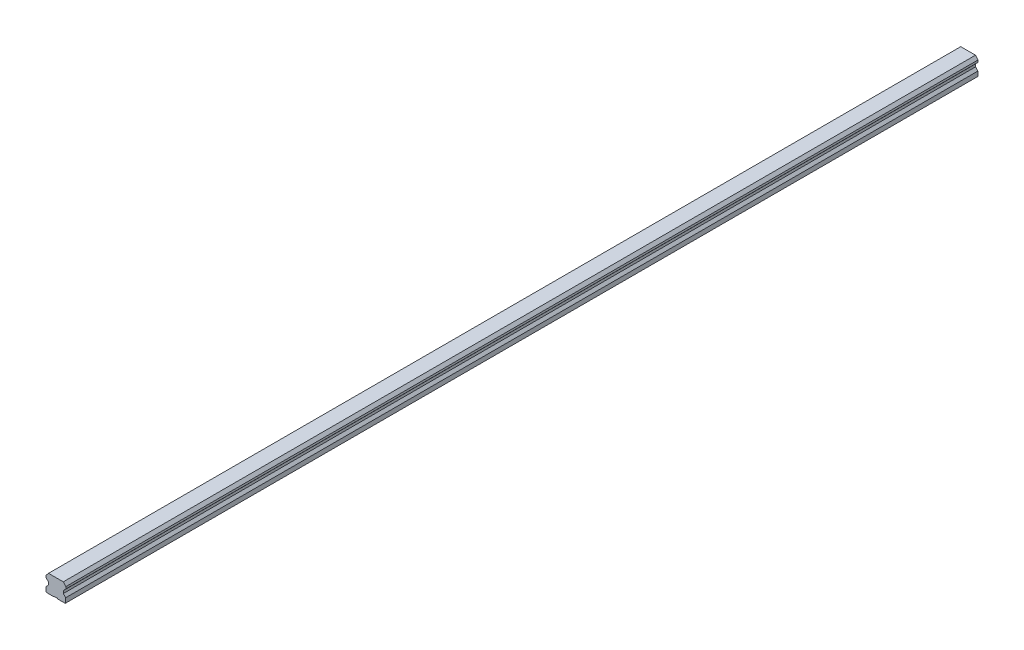
from build123d import *

# Parameters (mm, degrees)
EXTRUDE_1_DEPTH = 470


with BuildPart() as part:
    # 草图1 → 凸台-拉伸1 (new, symmetric)
    with BuildSketch(Plane.XY):
        Polygon((10.198060517, 15.211712223), (7.598340067, 18.189433578), (0, 18.189433578), (-7.598466158, 18.189433578), (-10.198186608, 15.211712223), (-10.198186608, 13.058876879), (-7.692519459, 10.438572741), (-7.692519459, 7.789953693), (-10, 5.165156487), (-10, 5.000194017), (-10, 0.355272087), (-9.644727913, 0), (-2.000943933, 0), (-1.650125997, 0.439438875), (1.650125997, 0.439438875), (2.000943933, 0), (9.644727913, 0), (10, 0.355272087), (10, 5.00019402), (10, 5.165156487), (7.692519459, 7.789953693), (7.692519459, 10.438572741), (10.198186608, 13.058876879), align=None)
    extrude(amount=EXTRUDE_1_DEPTH, both=True)


solid = part.part
